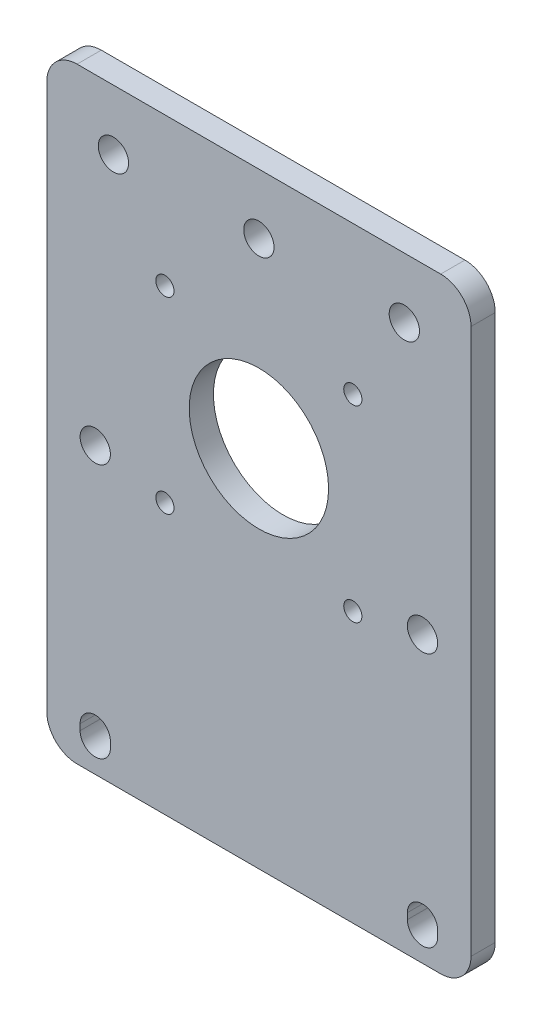
from build123d import *

# Parameters (mm, degrees)
SKETCH4_W           = 70
SKETCH4_H           = 100
SKETCH4_R           = 2.5
BOSS_EXTRUDE2_DEPTH = 4
SKETCH5_R           = 11.5
SKETCH5_R_2         = 1.5
CUT_EXTRUDE2_DEPTH  = 62.163714733
SKETCH6_R           = 2.5
CUT_EXTRUDE3_DEPTH  = 62.163714733
FILLET1_R           = 5


with BuildPart() as part:
    # Sketch4 → Boss-Extrude2 (new body)
    with BuildSketch(Plane.XY):
        Rectangle(SKETCH4_W, SKETCH4_H)
        with Locations((-27, -3)):
            Circle(SKETCH4_R, mode=Mode.SUBTRACT)
        with Locations(Location((27, -3, 0), (0, 0, 180))):
            Circle(SKETCH4_R, mode=Mode.SUBTRACT)
        with BuildLine():
            Line((-24.5, -44), (-24.5, -45))
            ThreePointArc((-24.5, -45), (-27, -47.5), (-29.5, -45))
            Line((-29.5, -45), (-29.5, -44))
            ThreePointArc((-29.5, -44), (-27, -41.5), (-24.5, -44))
        make_face(mode=Mode.SUBTRACT)
        with BuildLine():
            Line((24.5, -44), (24.5, -45))
            ThreePointArc((24.5, -45), (27, -47.5), (29.5, -45))
            Line((29.5, -45), (29.5, -44))
            ThreePointArc((29.5, -44), (27, -41.5), (24.5, -44))
        make_face(mode=Mode.SUBTRACT)
    extrude(amount=BOSS_EXTRUDE2_DEPTH)

    # Sketch5 → Cut-Extrude2 (cut, through all)
    with BuildSketch(Plane.XY.offset(4)):
        with Locations((0, 10.076696831)):
            Circle(SKETCH5_R)
        with Locations((-15.5, 25.576696831)):
            Circle(SKETCH5_R_2)
        with Locations(Location((15.5, 25.576696831, 0), (0, 0, 180))):
            Circle(SKETCH5_R_2)
        with Locations((15.5, -5.423303169)):
            Circle(SKETCH5_R_2)
        with Locations(Location((-15.5, -5.423303169, 0), (0, 0, 180))):
            Circle(SKETCH5_R_2)
    extrude(amount=-CUT_EXTRUDE2_DEPTH, mode=Mode.SUBTRACT)

    # Sketch6 → Cut-Extrude3 (cut, through all)
    with BuildSketch(Plane.XY.offset(4)):
        with Locations((24, 40.076696831)):
            Circle(SKETCH6_R)
        with Locations(Location((-24, 40.076696831, 0), (0, 0, 180))):
            Circle(SKETCH6_R)
        with Locations((0, 40.076696831)):
            Circle(SKETCH6_R)
    extrude(amount=-CUT_EXTRUDE3_DEPTH, mode=Mode.SUBTRACT)

    # Fillet1
    fillet1_edges = [part.edges().sort_by_distance(p)[0] for p in [
        (35, -50, 2),
        (-35, -50, 2),
        (-35, 50, 2),
        (35, 50, 2),
    ]]
    fillet(fillet1_edges, radius=FILLET1_R)


solid = part.part
